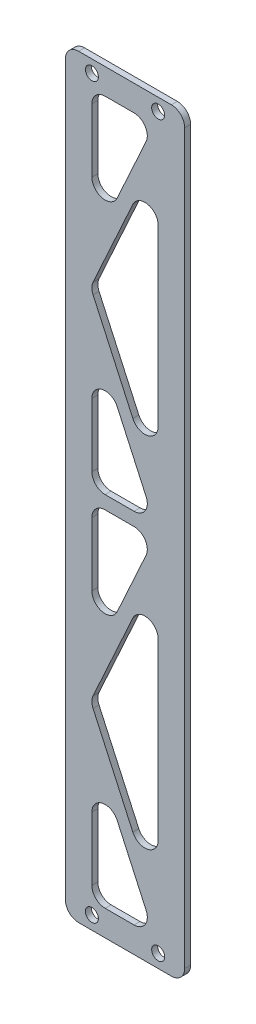
from build123d import *

# Parameters (mm, degrees)
SKETCH1_R           = 2.4892
BOSS_EXTRUDE1_DEPTH = 2.286
FILLET1_R           = 5.08


with BuildPart() as part:
    # Sketch1 → Boss-Extrude1 (new body)
    with BuildSketch(Plane.XY):
        with BuildLine():
            ThreePointArc((-10.16, 0), (-8.672102448, -3.592102448), (-5.08, -5.08))
            Line((-5.08, -5.08), (30.48, -5.08))
            ThreePointArc((30.48, -5.08), (34.072102448, -3.592102448), (35.56, 0))
            Line((35.56, 0), (35.56, 279.0825))
            ThreePointArc((35.56, 279.0825), (34.072102448, 282.674602448), (30.48, 284.1625))
            Line((30.48, 284.1625), (-5.08, 284.1625))
            ThreePointArc((-5.08, 284.1625), (-8.672102448, 282.674602448), (-10.16, 279.0825))
            Line((-10.16, 279.0825), (-10.16, 0))
        make_face()
        Circle(SKETCH1_R, mode=Mode.SUBTRACT)
        with BuildLine():
            Line((9.702242909, 36.253036461), (20.782825554, 11.949932204))
            ThreePointArc((20.782825554, 11.949932204), (20.433295811, 7.094715037), (16.160582646, 4.7625))
            Line((16.160582646, 4.7625), (5.08, 4.7625))
            ThreePointArc((5.08, 4.7625), (1.487897552, 6.250397552), (0, 9.8425))
            Line((0, 9.8425), (0, 34.145604258))
            ThreePointArc((0, 34.145604258), (4.001712927, 39.109846092), (9.702242909, 36.253036461))
        make_face(mode=Mode.SUBTRACT)
        with BuildLine():
            Line((0, 107.618145742), (0, 131.92125))
            ThreePointArc((0, 131.92125), (1.487897552, 135.513352448), (5.08, 137.00125))
            Line((5.08, 137.00125), (16.160582646, 137.00125))
            ThreePointArc((16.160582646, 137.00125), (20.433295811, 134.669034963), (20.782825554, 129.813817796))
            Line((20.782825554, 129.813817796), (9.702242909, 105.510713539))
            ThreePointArc((9.702242909, 105.510713539), (4.001712927, 102.653903908), (0, 107.618145742))
        make_face(mode=Mode.SUBTRACT)
        with Locations((25.4, 0)):
            Circle(SKETCH1_R, mode=Mode.SUBTRACT)
        with BuildLine():
            Line((15.697757091, 35.348465054), (0.457757091, 68.774442796))
            ThreePointArc((0.457757091, 68.774442796), (0, 70.881875), (0.457757091, 72.989307204))
            Line((0.457757091, 72.989307204), (15.697757091, 106.415284946))
            ThreePointArc((15.697757091, 106.415284946), (21.398287073, 109.272094577), (25.4, 104.307852743))
            Line((25.4, 104.307852743), (25.4, 37.455897257))
            ThreePointArc((25.4, 37.455897257), (21.398287073, 32.491655423), (15.697757091, 35.348465054))
        make_face(mode=Mode.SUBTRACT)
        with BuildLine():
            Line((0, 147.16125), (0, 171.464354258))
            ThreePointArc((0, 171.464354258), (4.001712927, 176.428596092), (9.702242909, 173.571786461))
            Line((9.702242909, 173.571786461), (20.782825554, 149.268682204))
            ThreePointArc((20.782825554, 149.268682204), (20.433295811, 144.413465037), (16.160582646, 142.08125))
            Line((16.160582646, 142.08125), (5.08, 142.08125))
            ThreePointArc((5.08, 142.08125), (1.487897552, 143.569147552), (0, 147.16125))
        make_face(mode=Mode.SUBTRACT)
        with BuildLine():
            ThreePointArc((0.457757091, 206.093192796), (0.115758165, 207.122337929), (0, 208.200625004))
            ThreePointArc((0, 208.200625004), (0.115758166, 209.278912075), (0.457757091, 210.308057204))
            Line((0.457757091, 210.308057204), (15.697757091, 243.734034946))
            ThreePointArc((15.697757091, 243.734034946), (21.398287073, 246.590844577), (25.4, 241.626602743))
            Line((25.4, 241.626602743), (25.4, 174.774647257))
            ThreePointArc((25.4, 174.774647257), (21.398287073, 169.810405423), (15.697757091, 172.667215054))
            Line((15.697757091, 172.667215054), (0.457757091, 206.093192796))
        make_face(mode=Mode.SUBTRACT)
        with Locations((0, 279.4)):
            Circle(SKETCH1_R, mode=Mode.SUBTRACT)
        with BuildLine():
            Line((5.08, 274.32), (16.160582646, 274.32))
            ThreePointArc((16.160582646, 274.32), (20.433295811, 271.987784963), (20.782825554, 267.132567796))
            Line((20.782825554, 267.132567796), (9.702242909, 242.829463539))
            ThreePointArc((9.702242909, 242.829463539), (4.001712927, 239.972653908), (0, 244.936895742))
            Line((0, 244.936895742), (0, 269.24))
            Line((0, 269.24), (0, 274.32))
            Line((0, 274.32), (5.08, 274.32))
        make_face(mode=Mode.SUBTRACT)
        with Locations((25.4, 279.4)):
            Circle(SKETCH1_R, mode=Mode.SUBTRACT)
    extrude(amount=BOSS_EXTRUDE1_DEPTH)

    # Fillet1
    fillet1_edges = [part.edges().sort_by_distance(p)[0] for p in [
        (0, 274.32, 1.143),
    ]]
    fillet(fillet1_edges, radius=FILLET1_R)


solid = part.part
